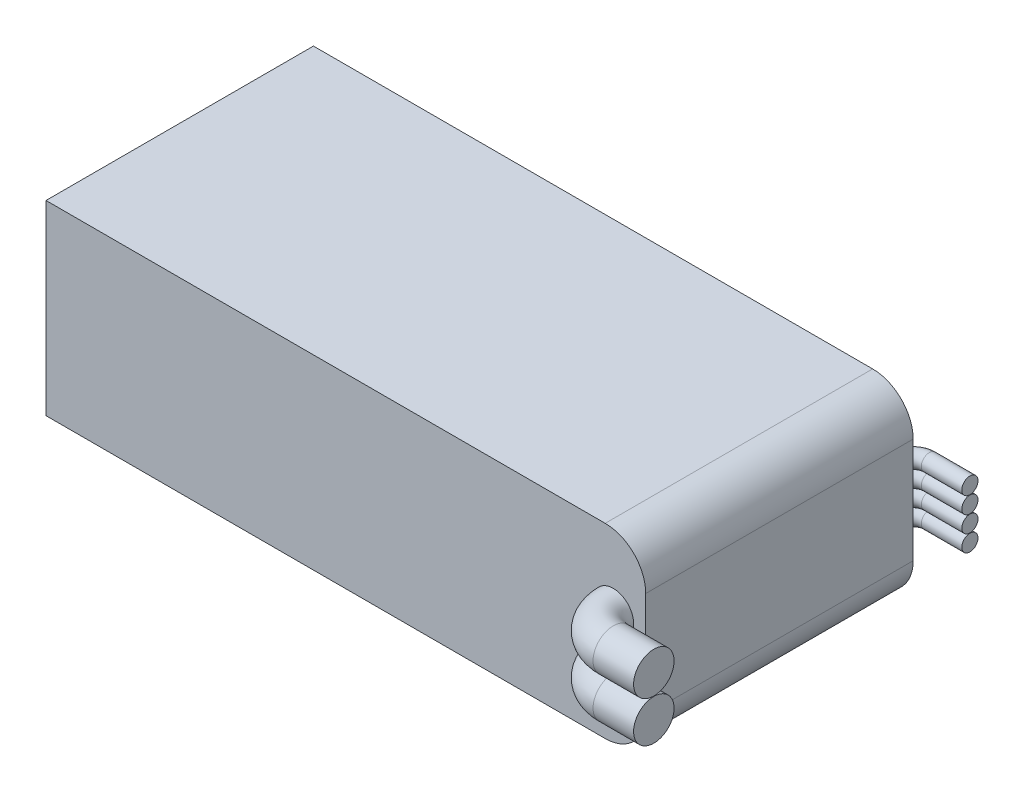
from build123d import *

# Parameters (mm, degrees)
SKETCH1_W           = 74
SKETCH1_H           = 33
BOSS_EXTRUDE1_DEPTH = 23
FILLET1_R           = 5
SKETCH2_R           = 2.5
SKETCH9_R           = 1


with BuildPart() as part:
    # Sketch1 → Boss-Extrude1 (new body)
    with BuildSketch(Plane(origin=(0, 0, 0), x_dir=(1, 0, 0), z_dir=(0, 1, 0))):
        Rectangle(SKETCH1_W, SKETCH1_H)
    extrude(amount=BOSS_EXTRUDE1_DEPTH)

    # Fillet1
    fillet1_edges = [part.edges().sort_by_distance(p)[0] for p in [
        (37, 23, 0),
        (37, 0, 0),
    ]]
    fillet(fillet1_edges, radius=FILLET1_R)

    # Sweep5: sweep along a path in Sketch7
    with BuildLine(Plane(origin=(0, 0, 0), x_dir=(-1, 0, 0), z_dir=(0, -1, 0))) as sweep5_path:
        Line((-42, -20.5), (-37, -20.5))
        ThreePointArc((-37, -20.5), (-34.171572875, -19.328427125), (-33, -16.5))
    # Sketch2 → Sweep5 (sweep)
    with BuildSketch(Plane.XY.offset(16.5)):
        with Locations((33, 14.05)):
            Circle(SKETCH2_R)
        with Locations((33, 9)):
            Circle(SKETCH2_R)
    sweep(path=sweep5_path.line)

    # Sweep6: sweep along a path in Sketch10
    with BuildLine(Plane(origin=(0, 0, 0), x_dir=(1, 0, 0), z_dir=(0, 1, 0))) as sweep6_path:
        Line((42, 18.5), (37, 18.5))
        ThreePointArc((37, 18.5), (35.585786438, 17.914213562), (35, 16.5))
    # Sketch9 → Sweep6 (sweep)
    with BuildSketch(Plane(origin=(0, 0, -16.5), x_dir=(-1, 0, 0), z_dir=(0, 0, -1))):
        with Locations((-35, 12.52)):
            Circle(SKETCH9_R)
        with Locations((-35, 10.48)):
            Circle(SKETCH9_R)
        with Locations((-35, 14.56)):
            Circle(SKETCH9_R)
        with Locations((-35, 8.44)):
            Circle(SKETCH9_R)
    sweep(path=sweep6_path.line)


solid = part.part
